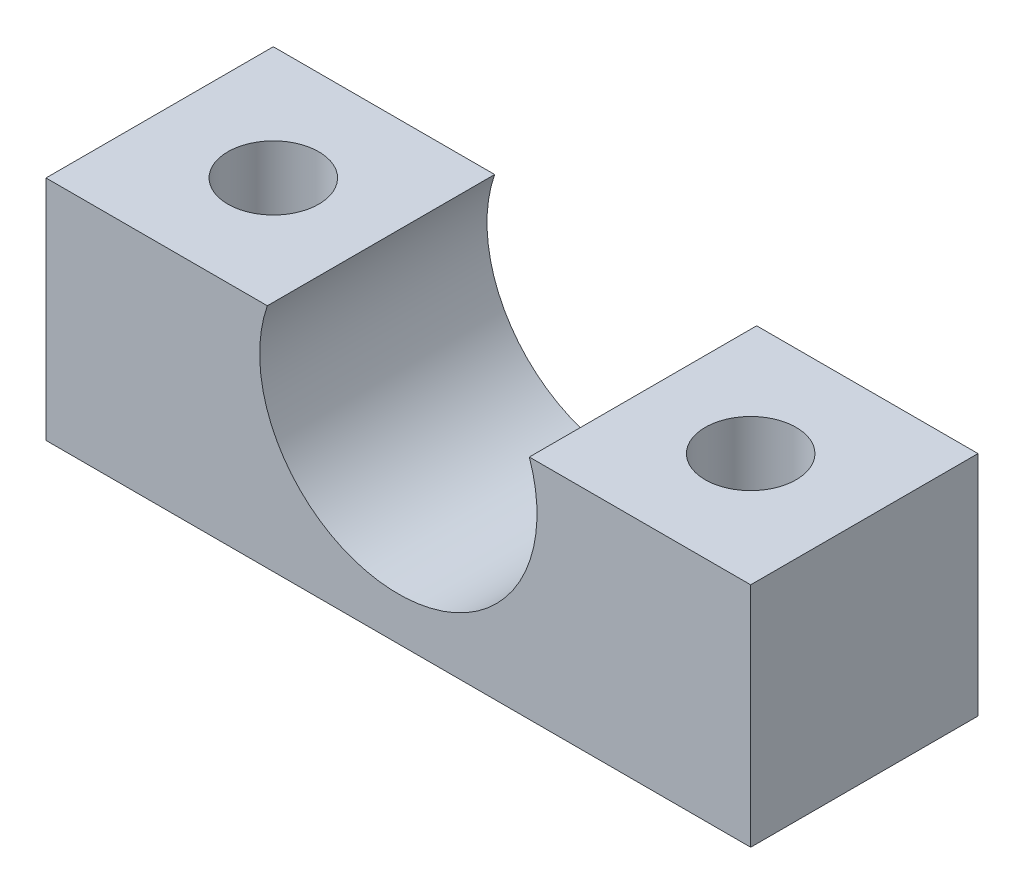
from build123d import *

# Parameters (mm, degrees)
SKETCH_1_R          = 15
EXTRUDE_1_DEPTH     = 10
CUT_EXTRUDE_1_DEPTH = 10
SKETCH_5_R          = 2
CUT_EXTRUDE_2_DEPTH = 25.779023387
SKETCH_7_W          = 30.648506912
SKETCH_7_H          = 10.688803122
CUT_EXTRUDE_4_DEPTH = 24.45207897
EXTRUDE_START       = -10
EXTRUDE_2_DEPTH     = 10


with BuildPart() as part:
    # ｽｹｯﾁ1 → ﾎﾞｽ - 押し出し1 (new body)
    with BuildSketch(Plane.XY):
        Circle(SKETCH_1_R)
    extrude(amount=EXTRUDE_1_DEPTH)

    # ｽｹｯﾁ2 → ｶｯﾄ - 押し出し1 (cut)
    with BuildSketch(Plane.XY.offset(10)):
        with BuildLine():
            Line((5.762811814, 2), (20.145888179, 2))
            Line((20.145888179, 2), (20.145888179, 26.748934653))
            Line((20.145888179, 26.748934653), (-19.854111821, 26.748934653))
            Line((-19.854111821, 26.748934653), (-19.854111821, 2))
            Line((-19.854111821, 2), (-5.762811814, 2))
            ThreePointArc((-5.762811814, 2), (0, -6.1), (5.762811814, 2))
        make_face()
    extrude(amount=-CUT_EXTRUDE_1_DEPTH, mode=Mode.SUBTRACT)

    # ｽｹｯﾁ5 → ｶｯﾄ - 押し出し2 (cut, through all)
    with BuildSketch(Plane(origin=(0, 2, 0), x_dir=(1, 0, 0), z_dir=(0, 1, 0))):
        with Locations(Location((-10.5, -5, 0), (0, 0, 270))):
            Circle(SKETCH_5_R)
        with Locations(Location((10.5, -5, 0), (0, 0, 270))):
            Circle(SKETCH_5_R)
    extrude(amount=-CUT_EXTRUDE_2_DEPTH, mode=Mode.SUBTRACT)

    # ｽｹｯﾁ7 → ｶｯﾄ - 押し出し4 (cut, through all)
    with BuildSketch(Plane.XY.offset(10)):
        with Locations((0, -13.344401561)):
            Rectangle(SKETCH_7_W, SKETCH_7_H)
    extrude(amount=-CUT_EXTRUDE_4_DEPTH, mode=Mode.SUBTRACT)

    # ｽｹｯﾁ8 → ﾎﾞｽ - 押し出し2 (add)
    with BuildSketch(Plane.XY.offset(10).offset(EXTRUDE_START)):
        with BuildLine():
            Line((-14.866068747, 2), (-15.5, 2))
            Line((-15.5, 2), (-15.5, -8))
            Line((-15.5, -8), (-12.68857754, -8))
            ThreePointArc((-12.68857754, -8), (-14.656555974, -3.191452176), (-14.866068747, 2))
        make_face()
        with BuildLine():
            ThreePointArc((14.866068747, 2), (14.656555974, -3.191452176), (12.68857754, -8))
            Line((12.68857754, -8), (15.5, -8))
            Line((15.5, -8), (15.5, 2))
            Line((15.5, 2), (14.866068747, 2))
        make_face()
    extrude(amount=EXTRUDE_2_DEPTH)


solid = part.part
